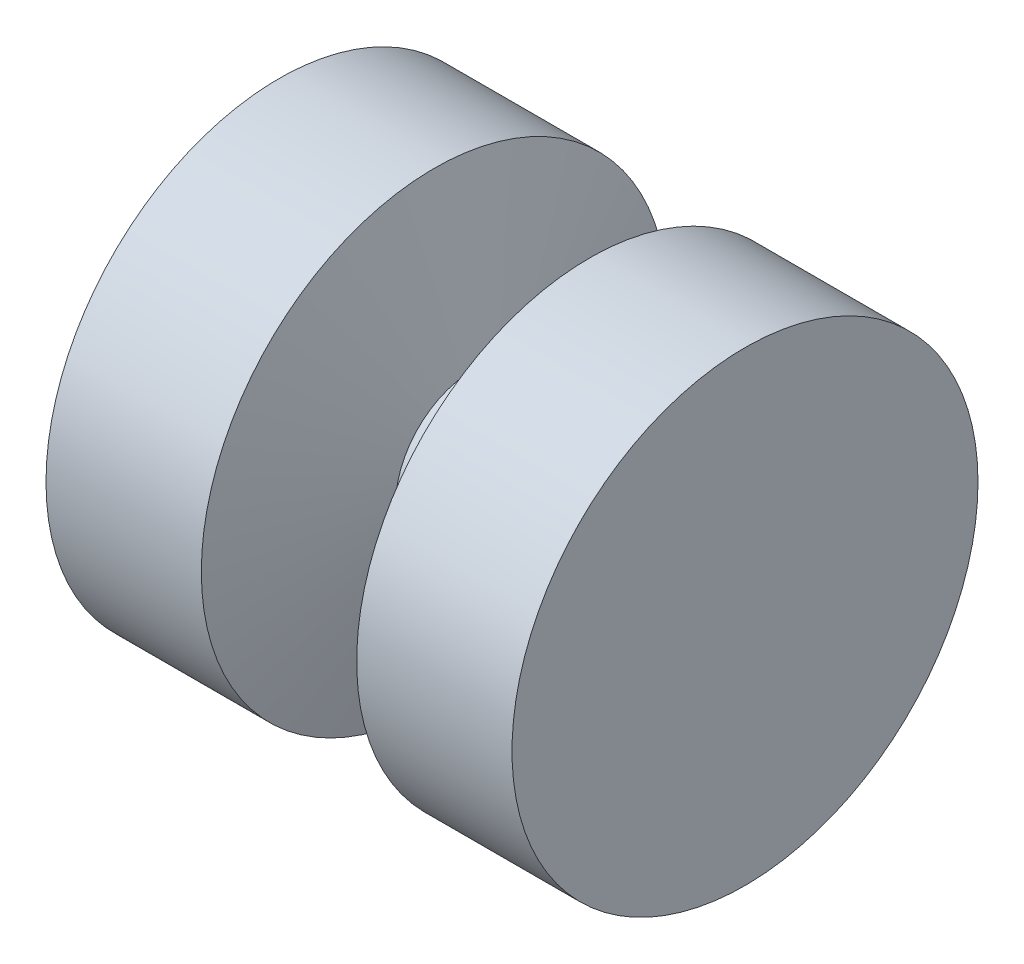
from build123d import *

# Parameters (mm, degrees)
SKETCH1_R           = 15
BOSS_EXTRUDE1_DEPTH = 15


with BuildPart() as part:
    # Sketch1 → Boss-Extrude1 (new, symmetric)
    with BuildSketch(Plane(origin=(0, 0, 0), x_dir=(0, 0, -1), z_dir=(1, 0, 0))):
        Circle(SKETCH1_R)
    extrude(amount=BOSS_EXTRUDE1_DEPTH, both=True)

    # Sketch2 → Cut-Revolve1 (revolve, cut)
    with BuildSketch(Plane.XY, mode=Mode.PRIVATE) as cut_revolve1_sk:
        Polygon((-5, 15), (5, 15), (2.5, 5), (-2.5, 5), align=None)
    revolve(cut_revolve1_sk.sketch.rotate(Axis((0, 0, 0), (1, 0, 0)), 90), axis=Axis((0, 0, 0), (1, 0, 0)), mode=Mode.SUBTRACT)


solid = part.part
